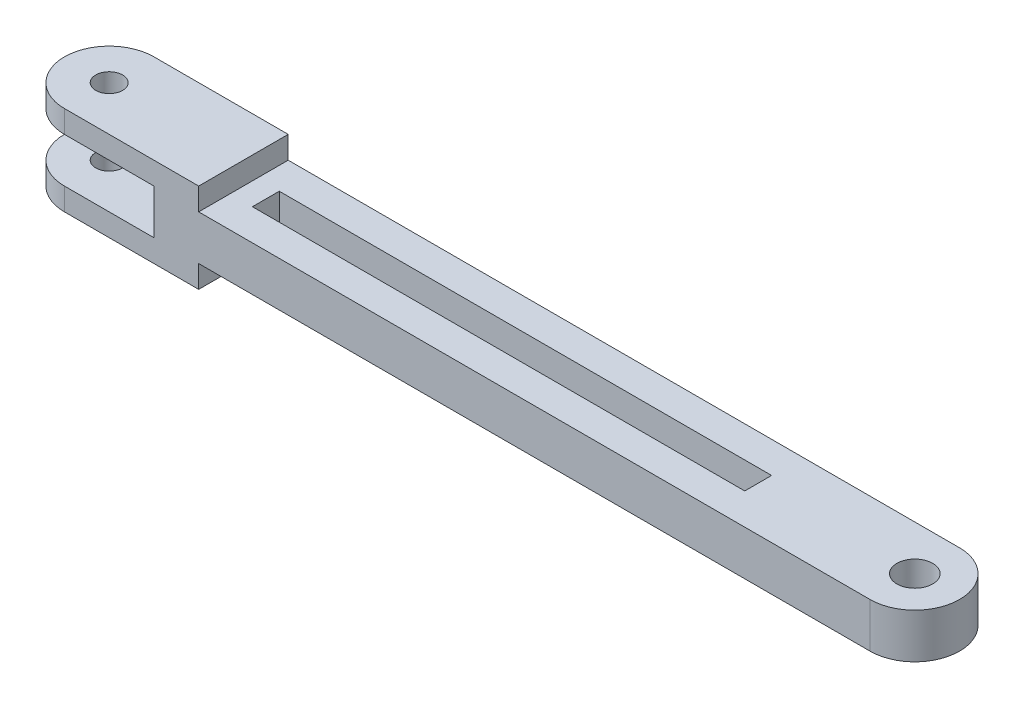
from build123d import *

# Parameters (mm, degrees)
SALIENTE_EXTRUIR1_DEPTH = 10
CROQUIS2_R              = 1.5
CROQUIS2_W              = 55
CROQUIS2_H              = 3
CORTAR_EXTRUIR1_DEPTH   = 10
CROQUIS3_W              = 15
CROQUIS3_H              = 2.5
CORTAR_EXTRUIR2_DEPTH   = 10
CROQUIS4_R              = 1.5
CORTAR_EXTRUIR3_DEPTH   = 10
CORTAR_EXTRUIR5_DEPTH   = 10
CROQUIS9_R              = 2
SALIENTE_EXTRUIR2_DEPTH = 2.5
CROQUIS10_W             = 70
CROQUIS10_H             = 16.144583998
CORTAR_EXTRUIR6_DEPTH   = 10


with BuildPart() as part:
    # Croquis1 → Saliente-Extruir1 (new body)
    with BuildSketch(Plane.XY):
        Polygon((0, 0), (105, 0), (105, 2.5), (105, 7.5), (105, 10), (0, 10), (0, 7.5), (15, 7.5), (15, 2.5), (0, 2.5), align=None)
    extrude(amount=SALIENTE_EXTRUIR1_DEPTH)

    # Croquis2 → Cortar-Extruir1 (cut)
    with BuildSketch(Plane(origin=(0, 10, 0), x_dir=(1, 0, 0), z_dir=(0, 1, 0))):
        with Locations(Location((5, -5, 0), (0, 0, 270))):
            Circle(CROQUIS2_R)
        with BuildLine():
            Line((-4.031911586, 0), (5, 0))
            ThreePointArc((5, 0), (0, -5), (5, -10))
            Line((5, -10), (-4.031911586, -10))
            Line((-4.031911586, -10), (-4.031911586, 0))
        make_face()
        with Locations((50, -5)):
            Rectangle(CROQUIS2_W, CROQUIS2_H)
    extrude(amount=-CORTAR_EXTRUIR1_DEPTH, mode=Mode.SUBTRACT)

    # Croquis3 → Cortar-Extruir2 (cut)
    with BuildSketch(Plane(origin=(0, 10, 0), x_dir=(1, 0, 0), z_dir=(0, 1, 0))):
        with Locations((97.5, -1.25)):
            Rectangle(CROQUIS3_W, CROQUIS3_H)
        with Locations((97.5, -8.75)):
            Rectangle(CROQUIS3_W, CROQUIS3_H)
    extrude(amount=-CORTAR_EXTRUIR2_DEPTH, mode=Mode.SUBTRACT)

    # Croquis4 → Cortar-Extruir3 (cut)
    with BuildSketch(Plane.XY.offset(7.5)):
        with Locations((100, 5)):
            Circle(CROQUIS4_R)
        with BuildLine():
            Line((100, 10), (171.112400038, 10))
            Line((171.112400038, 10), (171.112400038, 0))
            Line((171.112400038, 0), (100, 0))
            ThreePointArc((100, 0), (105, 5), (100, 10))
        make_face()
    extrude(amount=-CORTAR_EXTRUIR3_DEPTH, mode=Mode.SUBTRACT)

    # Croquis8 → Cortar-Extruir5 (cut)
    with BuildSketch(Plane.XY.offset(7.5)):
        with BuildLine():
            Line((90, 0), (100, 0))
            ThreePointArc((100, 0), (105, 5), (100, 10))
            Line((100, 10), (90, 10))
            Line((90, 10), (90, 0))
        make_face()
    extrude(amount=-CORTAR_EXTRUIR5_DEPTH, mode=Mode.SUBTRACT)

    # Croquis9 → Saliente-Extruir2 (add, symmetric)
    with BuildSketch(Plane(origin=(0, 5, 0), x_dir=(-1, 0, 0), z_dir=(0, -1, 0))):
        with BuildLine():
            Line((-90, -10), (-95, -10))
            ThreePointArc((-95, -10), (-100, -5), (-95, 0))
            Line((-95, 0), (-90, 0))
            Line((-90, 0), (-90, -10))
        make_face()
        with Locations(Location((-95, -5, 0), (0, 0, 90))):
            Circle(CROQUIS9_R, mode=Mode.SUBTRACT)
    extrude(amount=SALIENTE_EXTRUIR2_DEPTH, both=True)

    # Croquis10 → Cortar-Extruir6 (cut)
    with BuildSketch(Plane(origin=(0, 0, 0), x_dir=(-1, 0, 0), z_dir=(0, 0, -1))):
        with Locations((-55, 15.572291999)):
            Rectangle(CROQUIS10_W, CROQUIS10_H)
        with Locations((-55, -5.572291999)):
            Rectangle(CROQUIS10_W, CROQUIS10_H)
    extrude(amount=-CORTAR_EXTRUIR6_DEPTH, mode=Mode.SUBTRACT)


solid = part.part
